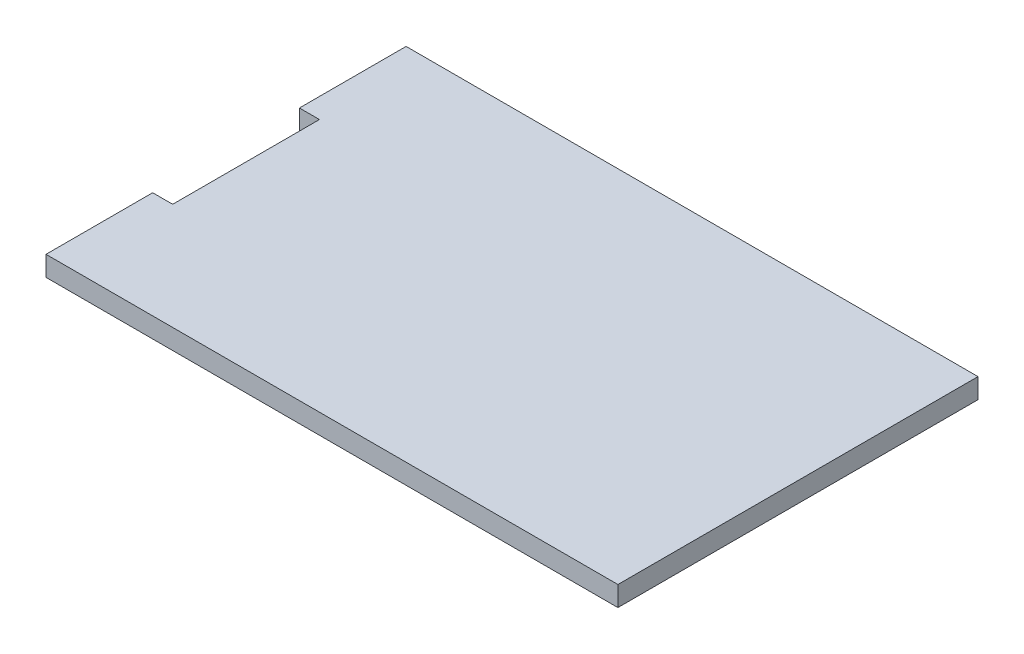
from build123d import *

# Parameters (mm, degrees)
BOSS_EXTRUDE1_DEPTH = 3


with BuildPart() as part:
    # Sketch1 → Boss-Extrude1 (new body)
    with BuildSketch(Plane(origin=(0, 0, 0), x_dir=(1, 0, 0), z_dir=(0, 1, 0))):
        Polygon((-42.8625, -26.9875), (42.8625, -26.9875), (42.8625, 26.9875), (-42.8625, 26.9875), (-42.8625, 11), (-39.8625, 11), (-39.8625, -11), (-42.8625, -11), align=None)
    extrude(amount=BOSS_EXTRUDE1_DEPTH)


solid = part.part
